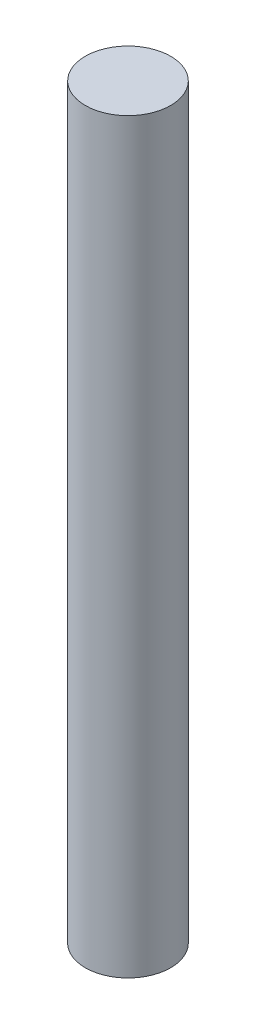
from build123d import *

# Parameters (mm, degrees)
SKETCH1_R           = 4000
BOSS_EXTRUDE1_DEPTH = 70000


with BuildPart() as part:
    # Sketch1 → Boss-Extrude1 (new body)
    with BuildSketch(Plane(origin=(0, 0, 0), x_dir=(1, 0, 0), z_dir=(0, 1, 0))):
        with Locations(Location((0, 0, 0), (0, 0, 270))):
            Circle(SKETCH1_R)
    extrude(amount=BOSS_EXTRUDE1_DEPTH)


solid = part.part
